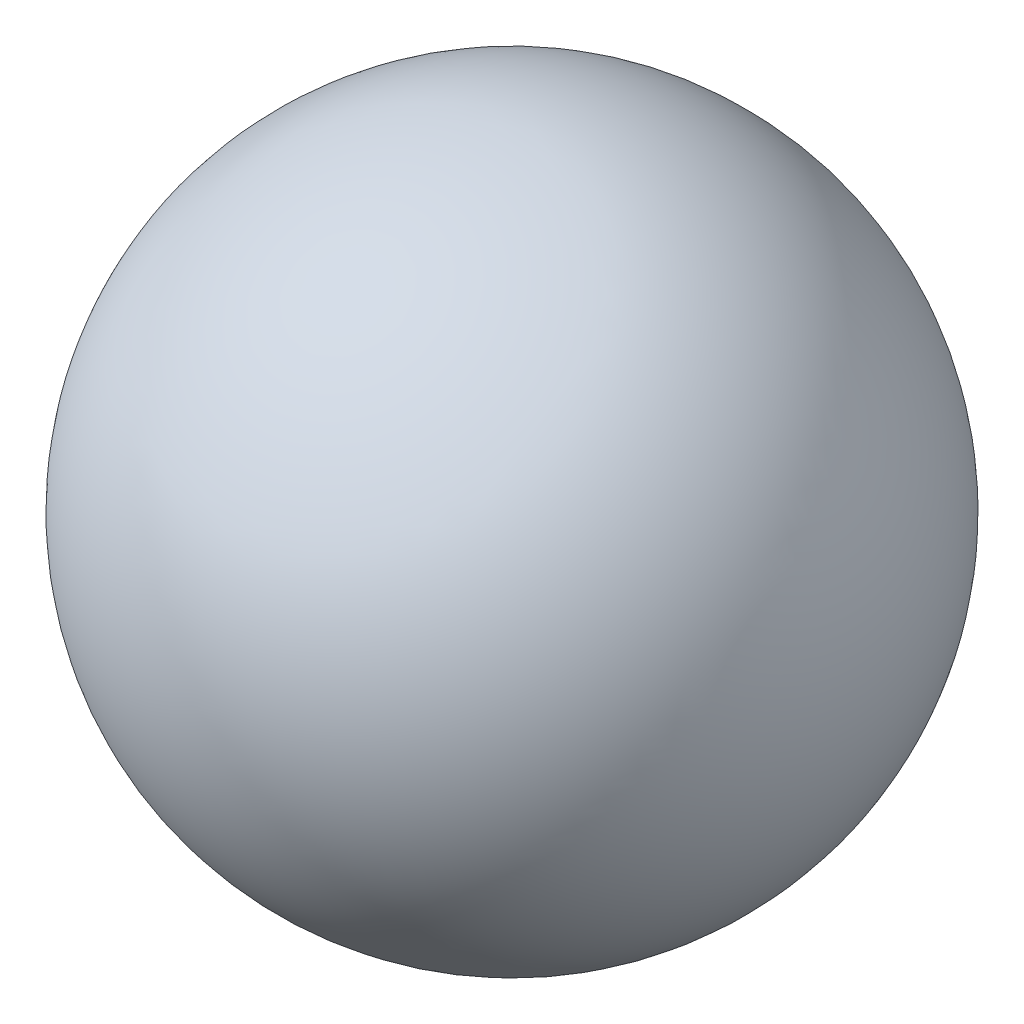
from build123d import *


with BuildPart() as part:
    # Sketch1 → Revolve2 (revolve)
    with BuildSketch(Plane(origin=(0, 0, 0), x_dir=(1, 0, 0), z_dir=(0, 1, 0))):
        with BuildLine():
            Line((0.762, 0), (-0.762, 0))
            ThreePointArc((-0.762, 0), (0, 0.762), (0.762, 0))
        make_face()
    revolve(axis=Axis((0.762, 0, 0), (-1, 0, 0)))


solid = part.part
